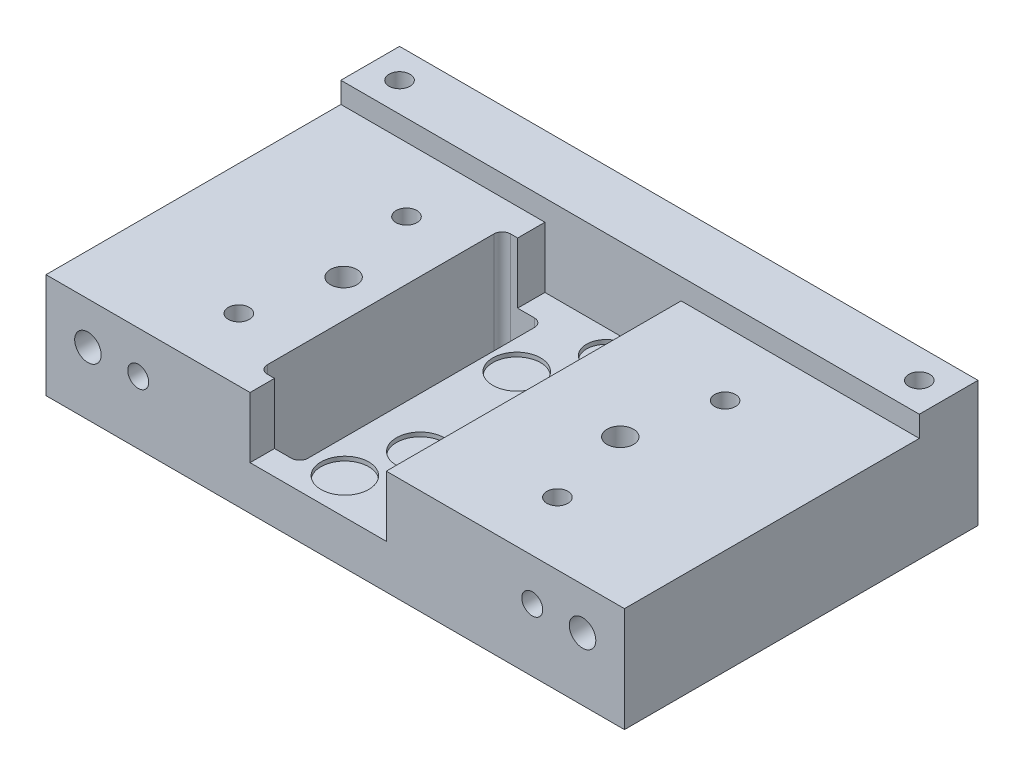
from build123d import *

# Parameters (mm, degrees)
SKETCH1_W                            = 55
SKETCH1_H                            = 42.17
BOSS_EXTRUDE1_DEPTH                  = 12.5
SKETCH2_W                            = 55
SKETCH2_H                            = 7
BOSS_EXTRUDE2_DEPTH                  = 2.5
SKETCH3_W                            = 16.25
SKETCH3_H                            = 35.17
CUT_EXTRUDE1_DEPTH                   = 7.25
CUT_EXTRUDE2_DEPTH                   = 71.424135777
SKETCH5_R                            = 2.85
SKETCH5_R_2                          = 2.35
CUT_EXTRUDE3_DEPTH                   = 0.5
SKETCH7_R                            = 5
BOSS_EXTRUDE3_DEPTH                  = 4
TAP_DRILL_FOR_10_32_TAP1_D           = 4.0386
TAP_DRILL_FOR_10_32_TAP1_DEPTH       = 4
TAP_DRILL_FOR_10_32_TAP1_CSINK_D     = 5.3086
TAP_DRILL_FOR_10_32_TAP1_CSINK_ANGLE = 90
TAP_DRILL_FOR_10_32_TAP1_TIP         = 1.213317848
SKETCH11_R                           = 1
CUT_EXTRUDE4_DEPTH                   = 71.059770197
TAP_DRILL_FOR_M3X0_5_TAP1_D          = 2.5
SKETCH15_R                           = 1.58
CUT_EXTRUDE5_DEPTH                   = 72.242956845
TAP_DRILL_FOR_M3X0_5_TAP3_D          = 2.5
TAP_DRILL_FOR_M3X0_5_TAP3_DEPTH      = 10
TAP_DRILL_FOR_M3X0_5_TAP3_TIP        = 0.751075774
BOSS_EXTRUDE4_DEPTH                  = 7
BOSS_EXTRUDE5_DEPTH                  = 7
SKETCH24_R                           = 1.58
CUT_EXTRUDE6_DEPTH                   = 10
TAP_DRILL_FOR_M3X0_5_TAP2_D          = 2.5


with BuildPart() as part:
    # Sketch1 → Boss-Extrude1 (new body)
    with BuildSketch(Plane(origin=(0, 0, 0), x_dir=(1, 0, 0), z_dir=(0, 1, 0))):
        with Locations((27.5, 21.085)):
            Rectangle(SKETCH1_W, SKETCH1_H)
    extrude(amount=BOSS_EXTRUDE1_DEPTH)

    # Sketch2 → Boss-Extrude2 (add)
    with BuildSketch(Plane(origin=(0, 12.5, 0), x_dir=(1, 0, 0), z_dir=(0, 1, 0))):
        with Locations((27.5, 38.67)):
            Rectangle(SKETCH2_W, SKETCH2_H)
    extrude(amount=BOSS_EXTRUDE2_DEPTH)

    # Sketch3 → Cut-Extrude1 (cut)
    with BuildSketch(Plane(origin=(0, 12.5, 0), x_dir=(1, 0, 0), z_dir=(0, 1, 0))):
        with Locations((25.465, 17.585)):
            Rectangle(SKETCH3_W, SKETCH3_H)
    extrude(amount=-CUT_EXTRUDE1_DEPTH, mode=Mode.SUBTRACT)

    # Sketch4 → Cut-Extrude2 (cut, through all)
    with BuildSketch(Plane(origin=(0, 12.5, 0), x_dir=(1, 0, 0), z_dir=(0, 1, 0))):
        with BuildLine():
            Line((15.5, 3.917342747), (15.5, 30.917342747))
            ThreePointArc((15.5, 30.917342747), (15.792893219, 31.624449528), (16.5, 31.917342747))
            Line((16.5, 31.917342747), (19.34, 31.917342747))
            ThreePointArc((19.34, 31.917342747), (20.047106781, 31.624449528), (20.34, 30.917342747))
            Line((20.34, 30.917342747), (20.34, 3.917342747))
            ThreePointArc((20.34, 3.917342747), (20.047106781, 3.210235966), (19.34, 2.917342747))
            Line((19.34, 2.917342747), (16.5, 2.917342747))
            ThreePointArc((16.5, 2.917342747), (15.792893219, 3.210235966), (15.5, 3.917342747))
        make_face()
    extrude(amount=-CUT_EXTRUDE2_DEPTH, mode=Mode.SUBTRACT)

    # Sketch5 → Cut-Extrude3 (cut)
    with BuildSketch(Plane(origin=(0, 5.25, 0), x_dir=(1, 0, 0), z_dir=(0, 1, 0))):
        with Locations(Location((24.34, 4.307342747, 0), (0, 0, 270))):
            Circle(SKETCH5_R)
        with Locations(Location((26.34, 11.307342747, 0), (0, 0, 270))):
            Circle(SKETCH5_R)
        with Locations(Location((29.84, 18.307342747, 0), (0, 0, 270))):
            Circle(SKETCH5_R)
        with Locations(Location((23.84, 25.307342747, 0), (0, 0, 270))):
            Circle(SKETCH5_R)
        with Locations(Location((27.52, 32.307342747, 0), (0, 0, 270))):
            Circle(SKETCH5_R_2)
    extrude(amount=-CUT_EXTRUDE3_DEPTH, mode=Mode.SUBTRACT)

    # Sketch7 → Boss-Extrude3 (add)
    with BuildSketch(Plane.XZ):
        with Locations(Location((27.52, -32.307342747, 0), (0, 0, 270))):
            Circle(SKETCH7_R)
    extrude(amount=BOSS_EXTRUDE3_DEPTH)

    # Tap Drill for #10-32 Tap1
    with Locations(Plane(origin=(0, -4, 0), x_dir=(-1, 0, 0), z_dir=(0, -1, 0))):
        with Locations((-27.52, 32.307342747)):
            CounterSinkHole(TAP_DRILL_FOR_10_32_TAP1_D / 2, TAP_DRILL_FOR_10_32_TAP1_CSINK_D / 2, depth=TAP_DRILL_FOR_10_32_TAP1_DEPTH, counter_sink_angle=TAP_DRILL_FOR_10_32_TAP1_CSINK_ANGLE)
            with Locations((0, 0, -(TAP_DRILL_FOR_10_32_TAP1_DEPTH + TAP_DRILL_FOR_10_32_TAP1_TIP / 2))):  # 118° drill point
                Cone(0, TAP_DRILL_FOR_10_32_TAP1_D / 2, TAP_DRILL_FOR_10_32_TAP1_TIP, mode=Mode.SUBTRACT)

    # Sketch11 → Cut-Extrude4 (cut, through all)
    with BuildSketch(Plane(origin=(0, 4.75, 0), x_dir=(1, 0, 0), z_dir=(0, 1, 0))):
        with Locations(Location((27.52, 32.307342747, 0), (0, 0, 270))):
            Circle(SKETCH11_R)
    extrude(amount=-CUT_EXTRUDE4_DEPTH, mode=Mode.SUBTRACT)

    # Tap Drill for M3x0.5 Tap1 (through all)
    with Locations(Plane(origin=(0, 12.5, 0), x_dir=(1, 0, 0), z_dir=(0, 1, 0))):
        with Locations((8.5, 7.5), (8.5, 27.5), (46.5, 27.5), (46.5, 7.5)):
            Hole(TAP_DRILL_FOR_M3X0_5_TAP1_D / 2)

    # Sketch15 → Cut-Extrude5 (cut, through all)
    with BuildSketch(Plane(origin=(0, 12.5, 0), x_dir=(1, 0, 0), z_dir=(0, 1, 0))):
        with Locations(Location((11, 17.5, 0), (0, 0, 270))):
            Circle(SKETCH15_R)
        with Locations(Location((44, 17.5, 0), (0, 0, 270))):
            Circle(SKETCH15_R)
    extrude(amount=-CUT_EXTRUDE5_DEPTH, mode=Mode.SUBTRACT)

    # Tap Drill for M3x0.5 Tap3
    with Locations(Plane.XY):
        with Locations((4, 7.5), (51, 7.5)):
            Hole(TAP_DRILL_FOR_M3X0_5_TAP3_D / 2, depth=TAP_DRILL_FOR_M3X0_5_TAP3_DEPTH)
            with Locations((0, 0, -(TAP_DRILL_FOR_M3X0_5_TAP3_DEPTH + TAP_DRILL_FOR_M3X0_5_TAP3_TIP / 2))):  # 118° drill point
                Cone(0, TAP_DRILL_FOR_M3X0_5_TAP3_D / 2, TAP_DRILL_FOR_M3X0_5_TAP3_TIP, mode=Mode.SUBTRACT)

    # Sketch22 → Boss-Extrude4 (add)
    with BuildSketch(Plane(origin=(55, 0, 0), x_dir=(0, 0, -1), z_dir=(1, 0, 0))):
        Polygon((0, 0), (42.17, 0), (42.17, 15), (35.17, 15), (35.17, 12.5), (0, 12.5), align=None)
    extrude(amount=BOSS_EXTRUDE4_DEPTH)

    # Sketch23 → Boss-Extrude5 (add)
    with BuildSketch(Plane.ZY):
        Polygon((0, 0), (0, 12.5), (-35.17, 12.5), (-35.17, 15), (-42.17, 15), (-42.17, 0), align=None)
    extrude(amount=BOSS_EXTRUDE5_DEPTH)

    # Sketch24 → Cut-Extrude6 (cut)
    with BuildSketch(Plane.XY):
        with Locations((57, 7.5)):
            Circle(SKETCH24_R)
        with Locations((-2, 7.5)):
            Circle(SKETCH24_R)
    extrude(amount=-CUT_EXTRUDE6_DEPTH, mode=Mode.SUBTRACT)

    # Tap Drill for M3x0.5 Tap2 (through all)
    with Locations(Plane(origin=(0, 15, 0), x_dir=(1, 0, 0), z_dir=(0, 1, 0))):
        with Locations((-3.5, 38.67), (58.5, 38.67)):
            Hole(TAP_DRILL_FOR_M3X0_5_TAP2_D / 2)


solid = part.part
